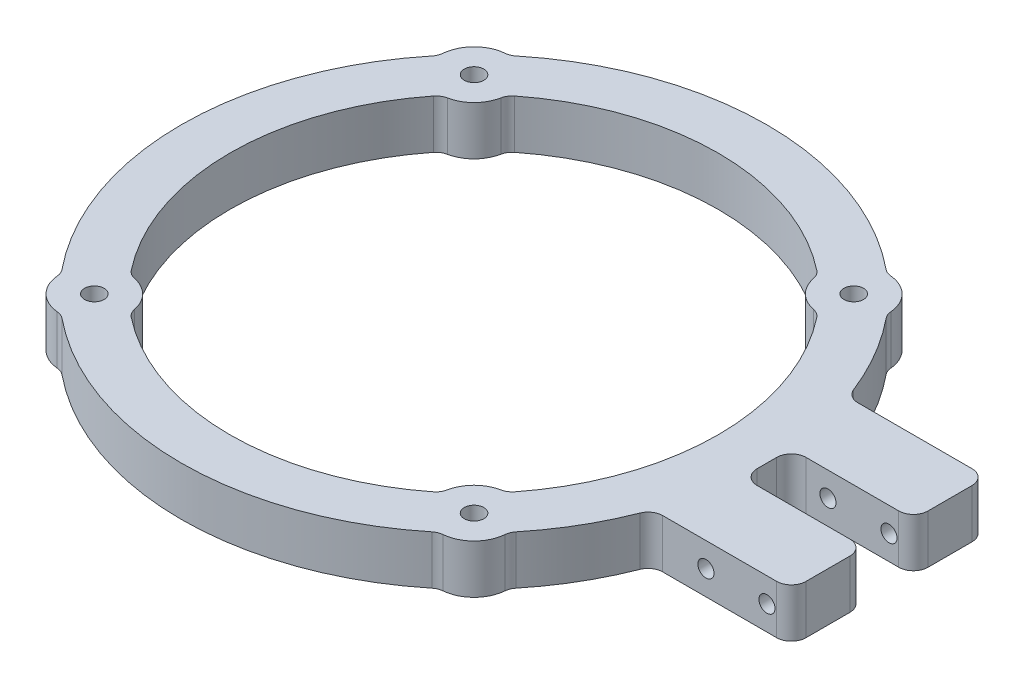
from build123d import *

# Parameters (mm, degrees)
SKETCH1_R                      = 50
BOSS_EXTRUDE1_DEPTH            = 10
SKETCH3_R                      = 7
BOSS_EXTRUDE2_DEPTH            = 10
SKETCH4_R                      = 2
CUT_EXTRUDE1_DEPTH             = 10
SKETCH8_W                      = 1.65
SKETCH8_H                      = 55
M4X0_7_TAPPED_HOLE1_AT_2_COUNT = 2
M4X0_7_TAPPED_HOLE1_AT_2_PITCH = 12.5
M4X0_7_TAPPED_HOLE2_D          = 3.3
FILLET1_R                      = 3


with BuildPart() as part:
    # Sketch1 → Boss-Extrude1 (new body)
    with BuildSketch(Plane(origin=(0, 0, 0), x_dir=(1, 0, 0), z_dir=(0, 1, 0))):
        with BuildLine():
            Line((56.568542495, -20), (85, -20))
            Line((85, -20), (85, -5))
            Line((85, -5), (60, -5))
            Line((60, -5), (60, 5))
            Line((60, 5), (85, 5))
            Line((85, 5), (85, 20))
            Line((85, 20), (56.568542495, 20))
            ThreePointArc((56.568542495, 20), (-60, 0), (56.568542495, -20))
        make_face()
        with Locations(Location((0, 0, 0), (0, 0, 270))):
            Circle(SKETCH1_R, mode=Mode.SUBTRACT)
    extrude(amount=BOSS_EXTRUDE1_DEPTH)

    # Sketch3 → Boss-Extrude2 (add)
    with BuildSketch(Plane(origin=(0, 10, 0), x_dir=(1, 0, 0), z_dir=(0, 1, 0))):
        with Locations((38.890872965, -38.890872965)):
            Circle(SKETCH3_R)
        with Locations((-38.890872965, -38.890872965)):
            Circle(SKETCH3_R)
        with Locations((-38.890872965, 38.890872965)):
            Circle(SKETCH3_R)
        with Locations((38.890872965, 38.890872965)):
            Circle(SKETCH3_R)
    extrude(amount=-BOSS_EXTRUDE2_DEPTH)

    # Sketch4 → Cut-Extrude1 (cut)
    with BuildSketch(Plane(origin=(0, 10, 0), x_dir=(1, 0, 0), z_dir=(0, 1, 0))):
        with Locations(Location((38.890872965, -38.890872965, 0), (0, 0, 270))):
            Circle(SKETCH4_R)
        with Locations(Location((-38.890872965, -38.890872965, 0), (0, 0, 270))):
            Circle(SKETCH4_R)
        with Locations(Location((-38.890872965, 38.890872965, 0), (0, 0, 270))):
            Circle(SKETCH4_R)
        with Locations(Location((38.890872965, 38.890872965, 0), (0, 0, 270))):
            Circle(SKETCH4_R)
    extrude(amount=-CUT_EXTRUDE1_DEPTH, mode=Mode.SUBTRACT)

    # Sketch8 → M4x0.7 Tapped Hole1 (revolve, cut)
    with BuildSketch(Plane(origin=(80, 5, 5), x_dir=(0, 1, 0), z_dir=(1, 0, 0))):
        with Locations((0.825, 27.5)):
            Rectangle(SKETCH8_W, SKETCH8_H)
    m4x0_7_tapped_hole1 = revolve(axis=Axis((80, 5, -1.35), (0, 0, 1)), mode=Mode.SUBTRACT)

    # M4x0.7 Tapped Hole1 at 2: M4x0.7 Tapped Hole1 ×2
    with Locations(*[(-i * M4X0_7_TAPPED_HOLE1_AT_2_PITCH, 0, 0) for i in range(1, M4X0_7_TAPPED_HOLE1_AT_2_COUNT)]):
        add(m4x0_7_tapped_hole1, mode=Mode.SUBTRACT)

    # M4x0.7 Tapped Hole2 (through all)
    with Locations(Plane.XY.offset(-5)):
        with Locations((80, 5), (67.5, 5)):
            Hole(M4X0_7_TAPPED_HOLE2_D / 2)

    # Fillet1
    fillet1_edges = [part.edges().sort_by_distance(p)[0] for p in [
        (85, 5, 20),
        (56.568542495, 5, 20),
        (56.568542495, 5, -20),
        (85, 5, -20),
        (85, 5, -5),
        (60, 5, -5),
        (60, 5, 5),
        (85, 5, 5),
        (38.50034739, 5, 31.901775042),
        (31.901775042, 5, 38.50034739),
        (38.657283604, 5, 45.886974452),
        (45.886974452, 5, 38.657283604),
        (-31.901775042, 5, 38.50034739),
        (-38.50034739, 5, 31.901775042),
        (-45.886974452, 5, 38.657283604),
        (-38.657283604, 5, 45.886974452),
        (-38.657283604, 5, -45.886974452),
        (-45.886974452, 5, -38.657283604),
        (-31.901775042, 5, -38.50034739),
        (-38.50034739, 5, -31.901775042),
        (45.886974452, 5, -38.657283604),
        (38.657283604, 5, -45.886974452),
        (38.50034739, 5, -31.901775042),
        (31.901775042, 5, -38.50034739),
    ]]
    fillet(fillet1_edges, radius=FILLET1_R)


solid = part.part
